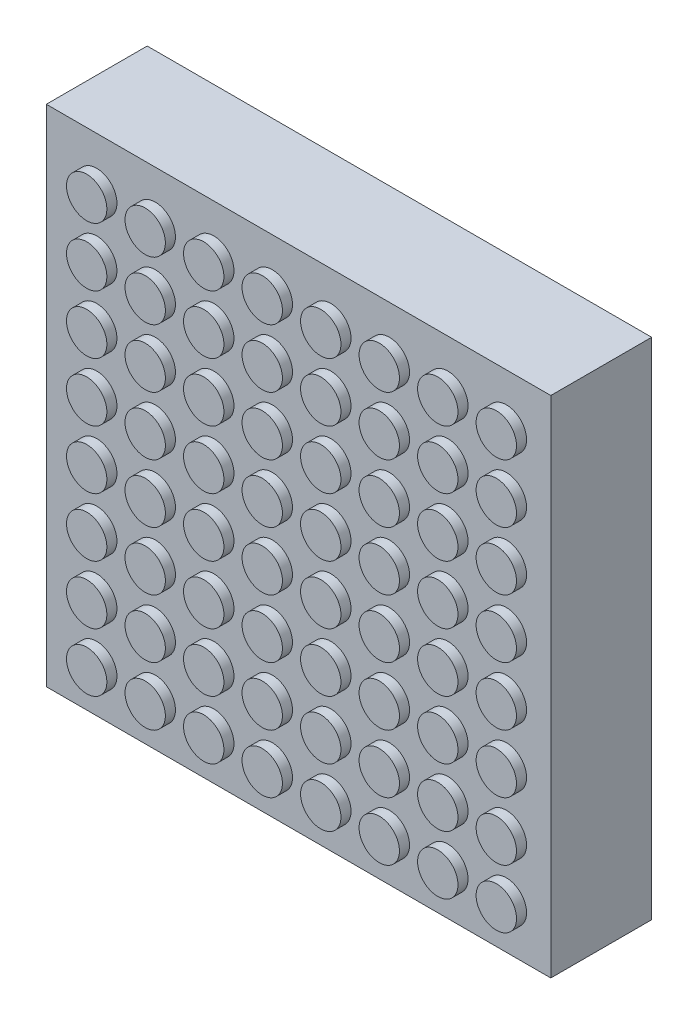
from build123d import *

# Parameters (mm, degrees)
SKETCH_1_W      = 50
SKETCH_1_H      = 50
EXTRUDE_1_DEPTH = 10
SKETCH_2_R      = 2
EXTRUDE_2_DEPTH = 1


with BuildPart() as part:
    # 草圖1 → 填料-伸長1 (new body)
    with BuildSketch(Plane.XY):
        with Locations((25, 25)):
            Rectangle(SKETCH_1_W, SKETCH_1_H)
    extrude(amount=EXTRUDE_1_DEPTH)

    # 草圖2 → 填料-伸長2 (add)
    with BuildSketch(Plane.XY.offset(10)):
        with Locations(Location((5, 45, 0), (0, 0, 180))):
            Circle(SKETCH_2_R)
        with Locations(Location((10.8, 45, 0), (0, 0, 180))):
            Circle(SKETCH_2_R)
        with Locations(Location((16.6, 45, 0), (0, 0, 180))):
            Circle(SKETCH_2_R)
        with Locations(Location((22.4, 45, 0), (0, 0, 180))):
            Circle(SKETCH_2_R)
        with Locations(Location((28.2, 45, 0), (0, 0, 180))):
            Circle(SKETCH_2_R)
        with Locations(Location((34, 45, 0), (0, 0, 180))):
            Circle(SKETCH_2_R)
        with Locations(Location((39.8, 45, 0), (0, 0, 180))):
            Circle(SKETCH_2_R)
        with Locations(Location((45.6, 45, 0), (0, 0, 180))):
            Circle(SKETCH_2_R)
        with Locations(Location((5, 39.2, 0), (0, 0, 180))):
            Circle(SKETCH_2_R)
        with Locations(Location((10.8, 39.2, 0), (0, 0, 180))):
            Circle(SKETCH_2_R)
        with Locations(Location((16.6, 39.2, 0), (0, 0, 180))):
            Circle(SKETCH_2_R)
        with Locations(Location((22.4, 39.2, 0), (0, 0, 180))):
            Circle(SKETCH_2_R)
        with Locations(Location((28.2, 39.2, 0), (0, 0, 180))):
            Circle(SKETCH_2_R)
        with Locations(Location((34, 39.2, 0), (0, 0, 180))):
            Circle(SKETCH_2_R)
        with Locations(Location((39.8, 39.2, 0), (0, 0, 180))):
            Circle(SKETCH_2_R)
        with Locations(Location((45.6, 39.2, 0), (0, 0, 180))):
            Circle(SKETCH_2_R)
        with Locations(Location((5, 33.4, 0), (0, 0, 180))):
            Circle(SKETCH_2_R)
        with Locations(Location((10.8, 33.4, 0), (0, 0, 180))):
            Circle(SKETCH_2_R)
        with Locations(Location((16.6, 33.4, 0), (0, 0, 180))):
            Circle(SKETCH_2_R)
        with Locations(Location((22.4, 33.4, 0), (0, 0, 180))):
            Circle(SKETCH_2_R)
        with Locations(Location((28.2, 33.4, 0), (0, 0, 180))):
            Circle(SKETCH_2_R)
        with Locations(Location((34, 33.4, 0), (0, 0, 180))):
            Circle(SKETCH_2_R)
        with Locations(Location((39.8, 33.4, 0), (0, 0, 180))):
            Circle(SKETCH_2_R)
        with Locations(Location((45.6, 33.4, 0), (0, 0, 180))):
            Circle(SKETCH_2_R)
        with Locations(Location((5, 27.6, 0), (0, 0, 180))):
            Circle(SKETCH_2_R)
        with Locations(Location((10.8, 27.6, 0), (0, 0, 180))):
            Circle(SKETCH_2_R)
        with Locations(Location((16.6, 27.6, 0), (0, 0, 180))):
            Circle(SKETCH_2_R)
        with Locations(Location((22.4, 27.6, 0), (0, 0, 180))):
            Circle(SKETCH_2_R)
        with Locations(Location((28.2, 27.6, 0), (0, 0, 180))):
            Circle(SKETCH_2_R)
        with Locations(Location((34, 27.6, 0), (0, 0, 180))):
            Circle(SKETCH_2_R)
        with Locations(Location((39.8, 27.6, 0), (0, 0, 180))):
            Circle(SKETCH_2_R)
        with Locations(Location((45.6, 27.6, 0), (0, 0, 180))):
            Circle(SKETCH_2_R)
        with Locations(Location((5, 21.8, 0), (0, 0, 180))):
            Circle(SKETCH_2_R)
        with Locations(Location((10.8, 21.8, 0), (0, 0, 180))):
            Circle(SKETCH_2_R)
        with Locations(Location((16.6, 21.8, 0), (0, 0, 180))):
            Circle(SKETCH_2_R)
        with Locations(Location((22.4, 21.8, 0), (0, 0, 180))):
            Circle(SKETCH_2_R)
        with Locations(Location((28.2, 21.8, 0), (0, 0, 180))):
            Circle(SKETCH_2_R)
        with Locations(Location((34, 21.8, 0), (0, 0, 180))):
            Circle(SKETCH_2_R)
        with Locations(Location((39.8, 21.8, 0), (0, 0, 180))):
            Circle(SKETCH_2_R)
        with Locations(Location((45.6, 21.8, 0), (0, 0, 180))):
            Circle(SKETCH_2_R)
        with Locations(Location((5, 16, 0), (0, 0, 180))):
            Circle(SKETCH_2_R)
        with Locations(Location((10.8, 16, 0), (0, 0, 180))):
            Circle(SKETCH_2_R)
        with Locations(Location((16.6, 16, 0), (0, 0, 180))):
            Circle(SKETCH_2_R)
        with Locations(Location((22.4, 16, 0), (0, 0, 180))):
            Circle(SKETCH_2_R)
        with Locations(Location((28.2, 16, 0), (0, 0, 180))):
            Circle(SKETCH_2_R)
        with Locations(Location((34, 16, 0), (0, 0, 180))):
            Circle(SKETCH_2_R)
        with Locations(Location((39.8, 16, 0), (0, 0, 180))):
            Circle(SKETCH_2_R)
        with Locations(Location((45.6, 16, 0), (0, 0, 180))):
            Circle(SKETCH_2_R)
        with Locations(Location((5, 10.2, 0), (0, 0, 180))):
            Circle(SKETCH_2_R)
        with Locations(Location((10.8, 10.2, 0), (0, 0, 180))):
            Circle(SKETCH_2_R)
        with Locations(Location((16.6, 10.2, 0), (0, 0, 180))):
            Circle(SKETCH_2_R)
        with Locations(Location((22.4, 10.2, 0), (0, 0, 180))):
            Circle(SKETCH_2_R)
        with Locations(Location((28.2, 10.2, 0), (0, 0, 180))):
            Circle(SKETCH_2_R)
        with Locations(Location((34, 10.2, 0), (0, 0, 180))):
            Circle(SKETCH_2_R)
        with Locations(Location((39.8, 10.2, 0), (0, 0, 180))):
            Circle(SKETCH_2_R)
        with Locations(Location((45.6, 10.2, 0), (0, 0, 180))):
            Circle(SKETCH_2_R)
        with Locations(Location((5, 4.4, 0), (0, 0, 180))):
            Circle(SKETCH_2_R)
        with Locations(Location((10.8, 4.4, 0), (0, 0, 180))):
            Circle(SKETCH_2_R)
        with Locations(Location((16.6, 4.4, 0), (0, 0, 180))):
            Circle(SKETCH_2_R)
        with Locations(Location((22.4, 4.4, 0), (0, 0, 180))):
            Circle(SKETCH_2_R)
        with Locations(Location((28.2, 4.4, 0), (0, 0, 180))):
            Circle(SKETCH_2_R)
        with Locations(Location((34, 4.4, 0), (0, 0, 180))):
            Circle(SKETCH_2_R)
        with Locations(Location((39.8, 4.4, 0), (0, 0, 180))):
            Circle(SKETCH_2_R)
        with Locations(Location((45.6, 4.4, 0), (0, 0, 180))):
            Circle(SKETCH_2_R)
    extrude(amount=EXTRUDE_2_DEPTH)


solid = part.part
